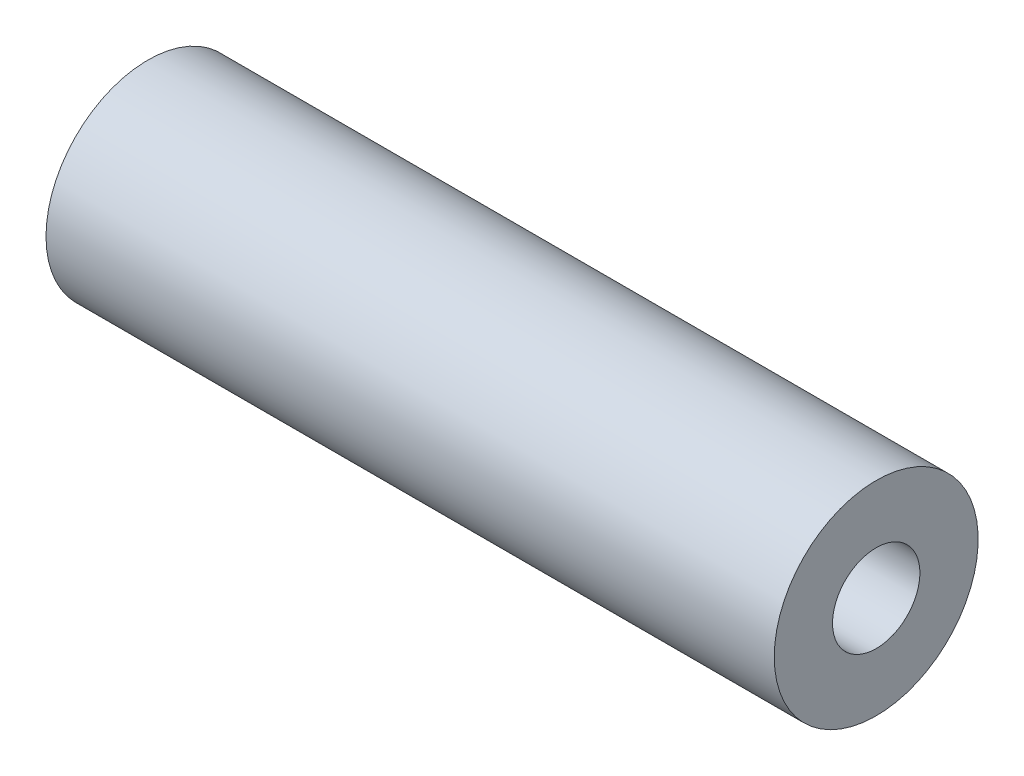
from build123d import *

# Parameters (mm, degrees)
SKETCH1_R           = 3.5
SKETCH1_R_2         = 1.5
BOSS_EXTRUDE1_DEPTH = 12.5


with BuildPart() as part:
    # Sketch1 → Boss-Extrude1 (new, symmetric)
    with BuildSketch(Plane(origin=(0, 0, 0), x_dir=(0, 0, -1), z_dir=(1, 0, 0))):
        with Locations(Location((0, 0, 0), (0, 0, 180))):
            Circle(SKETCH1_R)
        with Locations(Location((0, 0, 0), (0, 0, 180))):
            Circle(SKETCH1_R_2, mode=Mode.SUBTRACT)
    extrude(amount=BOSS_EXTRUDE1_DEPTH, both=True)


solid = part.part
